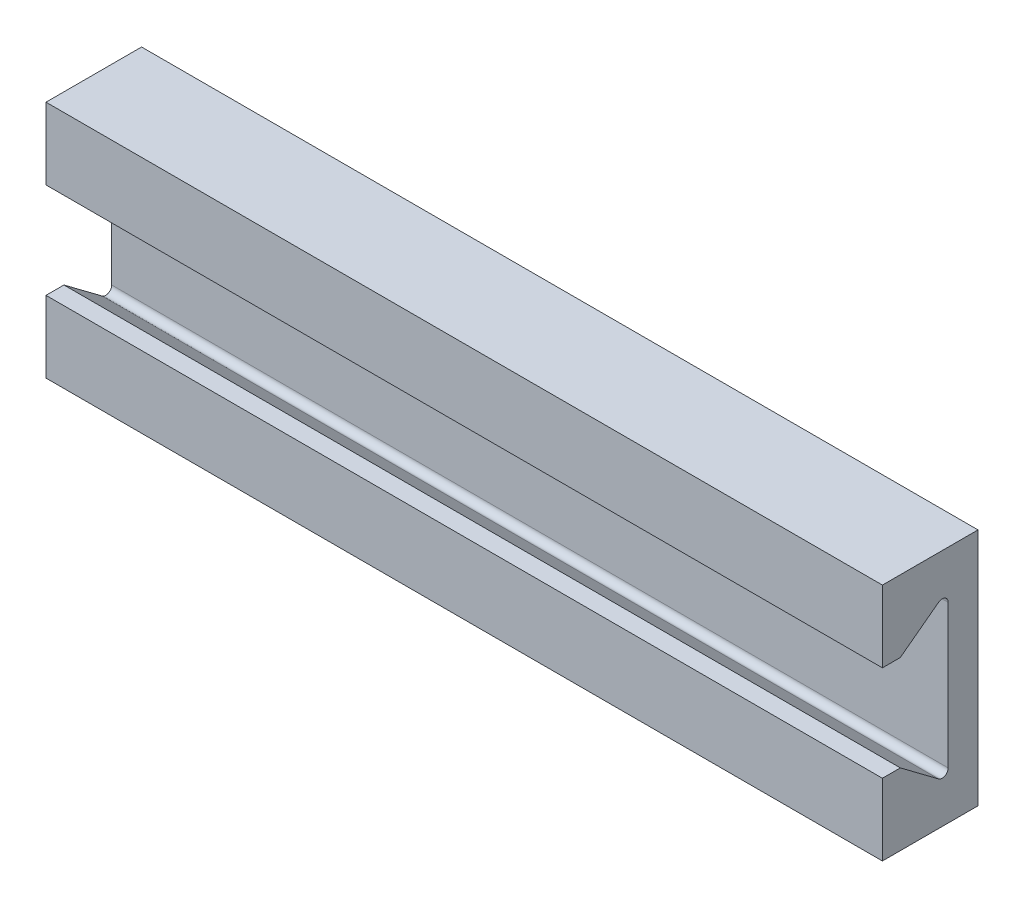
from build123d import *

# Parameters (mm, degrees)
SKETCH1_W           = 70
SKETCH1_H           = 20
BOSS_EXTRUDE1_DEPTH = 8
CUT_EXTRUDE1_DEPTH  = 74.239333694
FILLET1_R           = 0.5
FILLET2_R           = 0.5


with BuildPart() as part:
    # Sketch1 → Boss-Extrude1 (new body)
    with BuildSketch(Plane.XY):
        with Locations((35, 10)):
            Rectangle(SKETCH1_W, SKETCH1_H)
    extrude(amount=BOSS_EXTRUDE1_DEPTH)

    # Sketch2 → Cut-Extrude1 (cut, through all)
    with BuildSketch(Plane(origin=(70, 0, 0), x_dir=(0, 0, -1), z_dir=(1, 0, 0))):
        Polygon((-8, 6), (-6.5, 6), (-2.5, 3), (-2.5, 17), (-6.5, 14), (-8, 14), align=None)
    extrude(amount=-CUT_EXTRUDE1_DEPTH, mode=Mode.SUBTRACT)

    # Fillet1
    fillet1_edges = [part.edges().sort_by_distance(p)[0] for p in [
        (35, 3, 2.5),
    ]]
    fillet(fillet1_edges, radius=FILLET1_R)

    # Fillet2
    fillet2_edges = [part.edges().sort_by_distance(p)[0] for p in [
        (35, 17, 2.5),
    ]]
    fillet(fillet2_edges, radius=FILLET2_R)


solid = part.part
